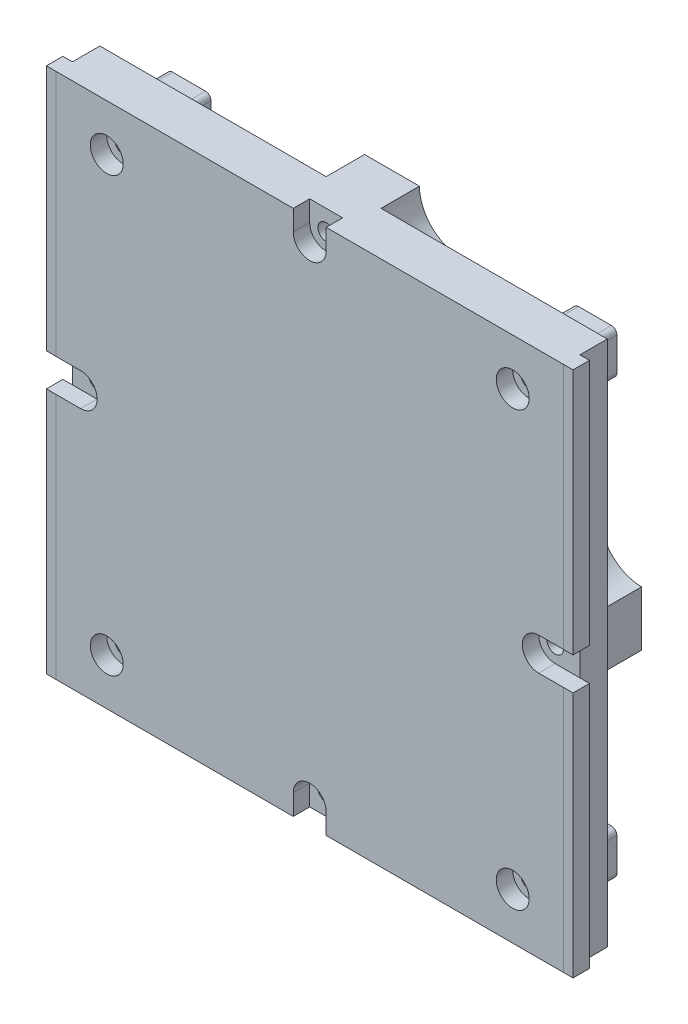
from build123d import *
from build123d.topology import SkipClean

# Parameters (mm, degrees)
SKETCH3_W           = 96
SKETCH3_H           = 3
BOSS_EXTRUDE1_DEPTH = 96
SKETCH4_R           = 1.5
BOSS_EXTRUDE2_DEPTH = 12
SKETCH5_R           = 1.5
BOSS_EXTRUDE3_DEPTH = 12
BOSS_EXTRUDE4_DEPTH = 5
SKETCH10_R          = 1.5
CUT_EXTRUDE1_DEPTH  = 70.519781358
SKETCH11_R          = 3
CUT_EXTRUDE2_DEPTH  = 3
CUT_EXTRUDE3_DEPTH  = 3


with BuildPart() as part:
    # Sketch3 → Boss-Extrude1 (new body)
    with BuildSketch(Plane(origin=(0, 48, 0), x_dir=(1, 0, 0), z_dir=(0, 1, 0))):
        with Locations((0, -1.5)):
            Rectangle(SKETCH3_W, SKETCH3_H)
    extrude(amount=-BOSS_EXTRUDE1_DEPTH)

    # Sketch4 → Boss-Extrude2 (add)
    # profile 1 of 4: a face of its own
    with BuildSketch(Plane(origin=(0, 0, 0), x_dir=(-1, 0, 0), z_dir=(0, 0, -1))):
        with BuildLine():
            Line((38, -12.5), (38, 12.5))
            ThreePointArc((38, 12.5), (40.196699141, 7.196699141), (45.5, 5))
            Line((45.5, 5), (45.5, -5))
            ThreePointArc((45.5, -5), (40.196699141, -7.196699141), (38, -12.5))
        make_face()
        with Locations(Location((41.75, 0, 0), (0, 0, 180))):
            Circle(SKETCH4_R, mode=Mode.SUBTRACT)
    # profile 2 of 4: a face of its own
    with BuildSketch(Plane(origin=(0, 0, 0), x_dir=(-1, 0, 0), z_dir=(0, 0, -1))):
        with BuildLine():
            Line((12.5, 40.5), (-12.5, 40.5))
            ThreePointArc((-12.5, 40.5), (-7.196699141, 42.696699141), (-5, 48))
            Line((-5, 48), (5, 48))
            ThreePointArc((5, 48), (7.196699141, 42.696699141), (12.5, 40.5))
        make_face()
        with Locations(Location((0, 44.25, 0), (0, 0, 180))):
            Circle(SKETCH4_R, mode=Mode.SUBTRACT)
    # profile 3 of 4: a face of its own
    with BuildSketch(Plane(origin=(0, 0, 0), x_dir=(-1, 0, 0), z_dir=(0, 0, -1))):
        with BuildLine():
            Line((-5, -48), (5, -48))
            ThreePointArc((5, -48), (7.196699141, -42.696699141), (12.5, -40.5))
            Line((12.5, -40.5), (-12.5, -40.5))
            ThreePointArc((-12.5, -40.5), (-7.196699141, -42.696699141), (-5, -48))
        make_face()
        with Locations(Location((0, -44.25, 0), (0, 0, 180))):
            Circle(SKETCH4_R, mode=Mode.SUBTRACT)
    # profile 4 of 4: a face of its own
    with BuildSketch(Plane(origin=(0, 0, 0), x_dir=(-1, 0, 0), z_dir=(0, 0, -1))):
        with BuildLine():
            Line((-45.5, 5), (-45.5, -5))
            ThreePointArc((-45.5, -5), (-40.196699141, -7.196699141), (-38, -12.5))
            Line((-38, -12.5), (-38, 12.5))
            ThreePointArc((-38, 12.5), (-40.196699141, 7.196699141), (-45.5, 5))
        make_face()
        with Locations(Location((-41.75, 0, 0), (0, 0, 180))):
            Circle(SKETCH4_R, mode=Mode.SUBTRACT)
    extrude(amount=BOSS_EXTRUDE2_DEPTH)

    # Sketch5 → Boss-Extrude3 (add)
    # profile 1 of 4: a face of its own
    with BuildSketch(Plane(origin=(0, 0, 0), x_dir=(-1, 0, 0), z_dir=(0, 0, -1))):
        with BuildLine():
            Line((-40, 35.5), (-34, 35.5))
            ThreePointArc((-34, 35.5), (-33.292893219, 35.792893219), (-33, 36.5))
            Line((-33, 36.5), (-33, 42.5))
            ThreePointArc((-33, 42.5), (-33.292893219, 43.207106781), (-34, 43.5))
            Line((-34, 43.5), (-40, 43.5))
            ThreePointArc((-40, 43.5), (-40.707106781, 43.207106781), (-41, 42.5))
            Line((-41, 42.5), (-41, 36.5))
            ThreePointArc((-41, 36.5), (-40.707106781, 35.792893219), (-40, 35.5))
        make_face()
        with Locations(Location((-37, 39.5, 0), (0, 0, 90))):
            Circle(SKETCH5_R, mode=Mode.SUBTRACT)
    # profile 2 of 4: a face of its own
    with BuildSketch(Plane(origin=(0, 0, 0), x_dir=(-1, 0, 0), z_dir=(0, 0, -1))):
        with BuildLine():
            Line((33, 36.5), (33, 42.5))
            ThreePointArc((33, 42.5), (33.292893219, 43.207106781), (34, 43.5))
            Line((34, 43.5), (40, 43.5))
            ThreePointArc((40, 43.5), (40.707106781, 43.207106781), (41, 42.5))
            Line((41, 42.5), (41, 36.5))
            ThreePointArc((41, 36.5), (40.707106781, 35.792893219), (40, 35.5))
            Line((40, 35.5), (34, 35.5))
            ThreePointArc((34, 35.5), (33.292893219, 35.792893219), (33, 36.5))
        make_face()
        with Locations(Location((37, 39.5, 0), (0, 0, 90))):
            Circle(SKETCH5_R, mode=Mode.SUBTRACT)
    # profile 3 of 4: a face of its own
    with BuildSketch(Plane(origin=(0, 0, 0), x_dir=(-1, 0, 0), z_dir=(0, 0, -1))):
        with BuildLine():
            Line((-33, -36.5), (-33, -42.5))
            ThreePointArc((-33, -42.5), (-33.292893219, -43.207106781), (-34, -43.5))
            Line((-34, -43.5), (-40, -43.5))
            ThreePointArc((-40, -43.5), (-40.707106781, -43.207106781), (-41, -42.5))
            Line((-41, -42.5), (-41, -36.5))
            ThreePointArc((-41, -36.5), (-40.707106781, -35.792893219), (-40, -35.5))
            Line((-40, -35.5), (-34, -35.5))
            ThreePointArc((-34, -35.5), (-33.292893219, -35.792893219), (-33, -36.5))
        make_face()
        with Locations(Location((-37, -39.5, 0), (0, 0, 90))):
            Circle(SKETCH5_R, mode=Mode.SUBTRACT)
    # profile 4 of 4: a face of its own
    with BuildSketch(Plane(origin=(0, 0, 0), x_dir=(-1, 0, 0), z_dir=(0, 0, -1))):
        with BuildLine():
            Line((40, -35.5), (34, -35.5))
            ThreePointArc((34, -35.5), (33.292893219, -35.792893219), (33, -36.5))
            Line((33, -36.5), (33, -42.5))
            ThreePointArc((33, -42.5), (33.292893219, -43.207106781), (34, -43.5))
            Line((34, -43.5), (40, -43.5))
            ThreePointArc((40, -43.5), (40.707106781, -43.207106781), (41, -42.5))
            Line((41, -42.5), (41, -36.5))
            ThreePointArc((41, -36.5), (40.707106781, -35.792893219), (40, -35.5))
        make_face()
        with Locations(Location((37, -39.5, 0), (0, 0, 90))):
            Circle(SKETCH5_R, mode=Mode.SUBTRACT)
    extrude(amount=BOSS_EXTRUDE3_DEPTH)

    # Sketch8 → Boss-Extrude4 (add)
    with BuildSketch(Plane(origin=(0, 0, 0), x_dir=(-1, 0, 0), z_dir=(0, 0, -1))):
        with BuildLine():
            Line((-38, 40.5), (-12.5, 40.5))
            ThreePointArc((-12.5, 40.5), (-7.196699141, 42.696699141), (-5, 48))
            Line((-5, 48), (-46.25, 48))
            Line((-46.25, 48), (-46.25, -48))
            Line((-46.25, -48), (-5, -48))
            ThreePointArc((-5, -48), (-7.196699141, -42.696699141), (-12.5, -40.5))
            Line((-12.5, -40.5), (-38, -40.5))
            Line((-38, -40.5), (-38, 40.5))
        make_face()
        with BuildLine():
            Line((12.5, 40.5), (38, 40.5))
            Line((38, 40.5), (38, -40.5))
            Line((38, -40.5), (12.5, -40.5))
            ThreePointArc((12.5, -40.5), (7.196699141, -42.696699141), (5, -48))
            Line((5, -48), (46.25, -48))
            Line((46.25, -48), (46.25, 48))
            Line((46.25, 48), (5, 48))
            ThreePointArc((5, 48), (7.196699141, 42.696699141), (12.5, 40.5))
        make_face()
    extrude(amount=BOSS_EXTRUDE4_DEPTH)

    # Sketch10 → Cut-Extrude1 (cut, through all)
    with BuildSketch(Plane.XY.offset(3)):
        with Locations((37, -39.5)):
            Circle(SKETCH10_R)
        with Locations((0, -44.25)):
            Circle(SKETCH10_R)
        with Locations((-37, -39.5)):
            Circle(SKETCH10_R)
        with Locations((-41.75, 0)):
            Circle(SKETCH10_R)
        with Locations((-37, 39.5)):
            Circle(SKETCH10_R)
        with Locations((0, 44.25)):
            Circle(SKETCH10_R)
        with Locations((37, 39.5)):
            Circle(SKETCH10_R)
        with Locations((41.75, 0)):
            Circle(SKETCH10_R)
    extrude(amount=-CUT_EXTRUDE1_DEPTH, mode=Mode.SUBTRACT)

    # Sketch11 → Cut-Extrude2 (cut)
    with SkipClean():  # the faces are left unmerged after this step: merging them gives an invalid solid
        with BuildSketch(Plane.XY.offset(3)):
            with Locations((0, -44.25)):
                Circle(SKETCH11_R)
            with Locations((-37, -39.5)):
                Circle(SKETCH11_R)
            with Locations((-41.75, 0)):
                Circle(SKETCH11_R)
            with Locations((-37, 39.5)):
                Circle(SKETCH11_R)
            with Locations((0, 44.25)):
                Circle(SKETCH11_R)
            with Locations(Location((37, -39.5, 0), (0, 0, 180))):
                Circle(SKETCH11_R)
            with Locations(Location((41.75, 0, 0), (0, 0, 180))):
                Circle(SKETCH11_R)
            with Locations(Location((37, 39.5, 0), (0, 0, 180))):
                Circle(SKETCH11_R)
        extrude(amount=-CUT_EXTRUDE2_DEPTH, mode=Mode.SUBTRACT)

    # Sketch12 → Cut-Extrude3 (cut)
    with BuildSketch(Plane.XY.offset(3)):
        with BuildLine():
            Line((3, -44.25), (3, -51.044271795))
            Line((3, -51.044271795), (-3, -51.044271795))
            Line((-3, -51.044271795), (-3, -44.24999935))
            ThreePointArc((-3, -44.24999935), (-3.25e-07, -47.25), (3, -44.25))
        make_face()
        with BuildLine():
            Line((3, 44.25), (3, 51.044271795))
            Line((3, 51.044271795), (-3, 51.044271795))
            Line((-3, 51.044271795), (-3, 44.24999935))
            ThreePointArc((-3, 44.24999935), (-3.25e-07, 47.25), (3, 44.25))
        make_face()
        with BuildLine():
            Line((41.75, -3), (50.168428877, -3))
            Line((50.168428877, -3), (50.168428877, 3))
            Line((50.168428877, 3), (41.75, 3))
            ThreePointArc((41.75, 3), (44.75, 0), (41.75, -3))
        make_face()
        with BuildLine():
            Line((-50.168428877, -3), (-50.168428877, 3))
            Line((-50.168428877, 3), (-41.75, 3))
            ThreePointArc((-41.75, 3), (-44.75, 0), (-41.75, -3))
            Line((-41.75, -3), (-50.168428877, -3))
        make_face()
    extrude(amount=-CUT_EXTRUDE3_DEPTH, mode=Mode.SUBTRACT)


solid = part.part
